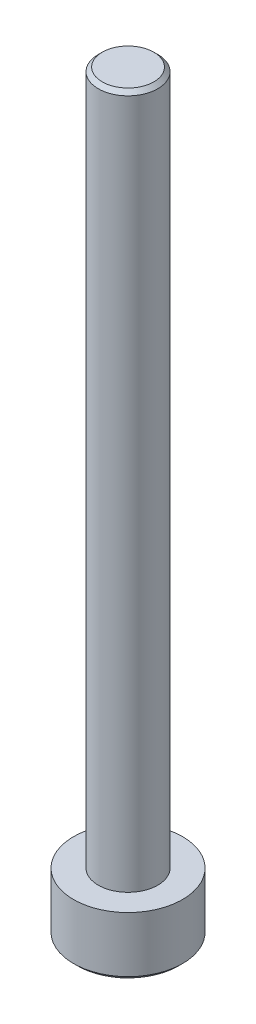
from build123d import *

# Parameters (mm, degrees)
SIMPLIFIED_START                    = -3
SIMPLIFIED_NOMINAL_HEX_SOCKET_DEPTH = 1.5


with BuildPart() as part:
    # Reconstructed nominal axial profile → Native revolved geometry (revolve)
    with BuildSketch(Plane.XY, mode=Mode.PRIVATE) as native_revolved_geometry_sk:
        Polygon((0, -3), (2.55, -3), (2.75, -2.8), (2.75, 0), (1.5, 0), (1.5, 34.8), (1.3, 35), (0, 35), align=None)
    revolve(native_revolved_geometry_sk.sketch.rotate(Axis((0, -500, 0), (0, 1, 0)), 90), axis=Axis((0, -500, 0), (0, 1, 0)))

    # Sketch2 → Simplified nominal hex socket (cut)
    with BuildSketch(Plane(origin=(0, 0, 0), x_dir=(1, 0, 0), z_dir=(0, 1, 0)).offset(SIMPLIFIED_START)):
        Polygon((1.443375673, 0), (0.721687836, -1.25), (-0.721687836, -1.25), (-1.443375673, 0), (-0.721687836, 1.25), (0.721687836, 1.25), align=None)
    extrude(amount=SIMPLIFIED_NOMINAL_HEX_SOCKET_DEPTH, mode=Mode.SUBTRACT)


solid = part.part
